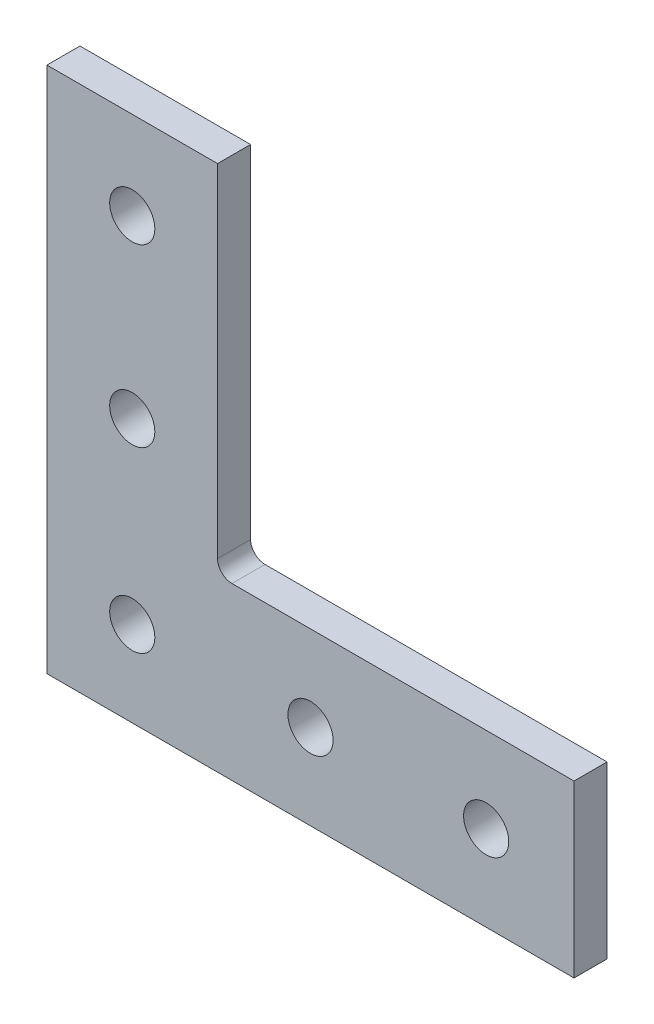
from build123d import *

# Parameters (mm, degrees)
BOSS_EXTRUDE1_DEPTH      = 2.3876
BOSS_EXTRUDE1_DEPTH_BACK = 2.3876
CUT_EXTRUDE1_DEPTH       = 55.092721646
CUT_EXTRUDE1_DEPTH_BACK  = 55.092721646
SKETCH4_R                = 3.2639


with BuildPart() as part:
    # Sketch3 → Boss-Extrude1 (new, two sides: drawn at the far end of the back side and taken through both)
    with BuildSketch(Plane.XY.offset(-BOSS_EXTRUDE1_DEPTH_BACK)):
        with BuildLine():
            Line((-13.4366, 38.1), (-38.1, 38.1))
            Line((-38.1, 38.1), (-38.1, -38.1))
            Line((-38.1, -38.1), (38.1, -38.1))
            Line((38.1, -38.1), (38.1, -13.4366))
            Line((38.1, -13.4366), (-11.3538, -13.4366))
            ThreePointArc((-11.3538, -13.4366), (-12.826562004, -12.826562004), (-13.4366, -11.3538))
            Line((-13.4366, -11.3538), (-13.4366, 38.1))
        make_face()
    extrude(amount=BOSS_EXTRUDE1_DEPTH + BOSS_EXTRUDE1_DEPTH_BACK)

    # Sketch4 → Cut-Extrude1 (cut, two sides: drawn at the far end of the back side and taken through both)
    with BuildSketch(Plane.XY.offset(2.3876).offset(-CUT_EXTRUDE1_DEPTH_BACK)):
        with Locations((-25.7683, 25.4)):
            Circle(SKETCH4_R)
        with Locations((-25.7683, 0)):
            Circle(SKETCH4_R)
        with Locations(Location((0, -25.7683, 0), (0, 0, 180))):
            Circle(SKETCH4_R)
        with Locations(Location((25.4, -25.7683, 0), (0, 0, 180))):
            Circle(SKETCH4_R)
        with Locations((-25.7683, -25.7683)):
            Circle(SKETCH4_R)
    extrude(amount=CUT_EXTRUDE1_DEPTH + CUT_EXTRUDE1_DEPTH_BACK, mode=Mode.SUBTRACT)


solid = part.part
